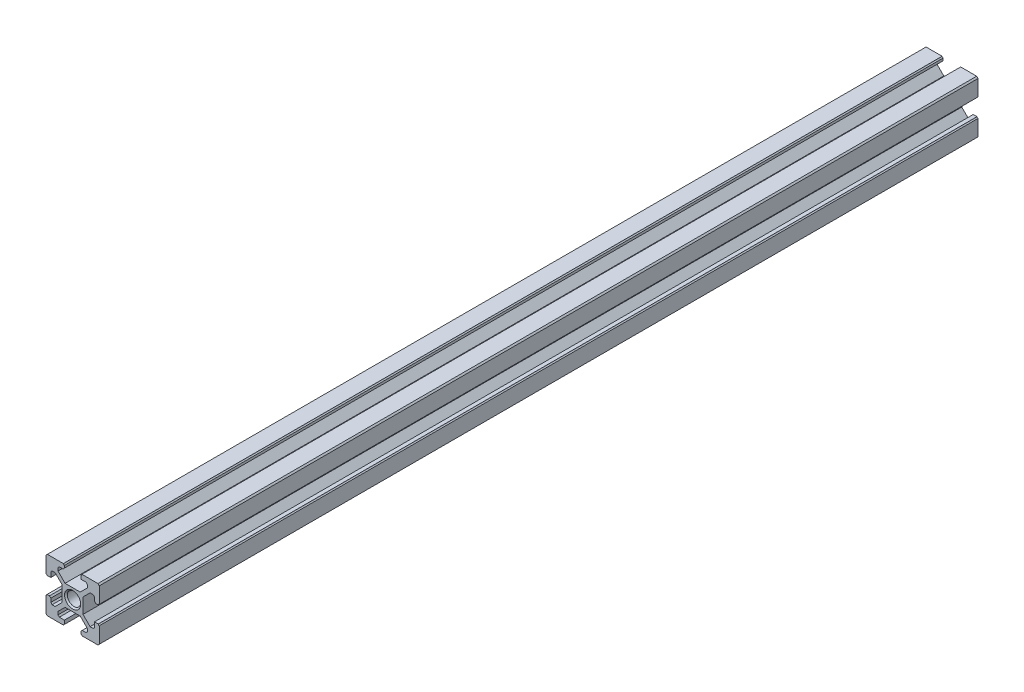
from build123d import *

# Parameters (mm, degrees)
BOSS_EXTRUDE1_DEPTH             = 330
M6X1_0_TAPPED_HOLE2_D           = 5
M6X1_0_TAPPED_HOLE2_DEPTH       = 28.497848452
M6X1_0_TAPPED_HOLE2_CSINK_D     = 6.05
M6X1_0_TAPPED_HOLE2_CSINK_ANGLE = 90
M6X1_0_TAPPED_HOLE2_TIP         = 1.502151548


with BuildPart() as part:
    # Sketch1 → Boss-Extrude1 (new body)
    with BuildSketch(Plane.XY):
        with BuildLine():
            Line((-9.5, 10), (-3.486470896, 10))
            ThreePointArc((-3.486470896, 10), (-3.373276191, 9.726723809), (-3.1, 9.613529104))
            Line((-3.1, 9.613529104), (-3.1, 8.7))
            Line((-3.1, 8.7), (-3.6, 8.2))
            Line((-3.6, 8.2), (-5, 8.2))
            Line((-5, 8.2), (-5.5, 7.7))
            Line((-5.5, 7.7), (-5.5, 6.560660172))
            Line((-5.5, 6.560660172), (-2.839339828, 3.9))
            Line((-2.839339828, 3.9), (0, 3.9))
            Line((0, 3.9), (2.839339828, 3.9))
            Line((2.839339828, 3.9), (5.5, 6.560660172))
            Line((5.5, 6.560660172), (5.5, 7.7))
            Line((5.5, 7.7), (5, 8.2))
            Line((5, 8.2), (3.1, 8.2))
            Line((3.1, 8.2), (3.1, 9.613529104))
            ThreePointArc((3.1, 9.613529104), (3.373276191, 9.726723809), (3.486470896, 10))
            Line((3.486470896, 10), (9.5, 10))
            Line((9.5, 10), (10, 9.5))
            Line((10, 9.5), (10, 3.486470896))
            ThreePointArc((10, 3.486470896), (9.726723809, 3.373276191), (9.613529104, 3.1))
            Line((9.613529104, 3.1), (8.7, 3.1))
            Line((8.7, 3.1), (8.2, 3.6))
            Line((8.2, 3.6), (8.2, 5))
            Line((8.2, 5), (7.7, 5.5))
            Line((7.7, 5.5), (6.560660172, 5.5))
            Line((6.560660172, 5.5), (3.9, 2.839339828))
            Line((3.9, 2.839339828), (3.9, 0))
            Line((3.9, 0), (3.9, -2.839339828))
            Line((3.9, -2.839339828), (6.560660172, -5.5))
            Line((6.560660172, -5.5), (7.7, -5.5))
            Line((7.7, -5.5), (8.2, -5))
            Line((8.2, -5), (8.2, -3.1))
            Line((8.2, -3.1), (9.613529104, -3.1))
            ThreePointArc((9.613529104, -3.1), (9.726723809, -3.373276191), (10, -3.486470896))
            Line((10, -3.486470896), (10, -9.5))
            Line((10, -9.5), (9.5, -10))
            Line((9.5, -10), (3.486470896, -10))
            ThreePointArc((3.486470896, -10), (3.373276191, -9.726723809), (3.1, -9.613529104))
            Line((3.1, -9.613529104), (3.1, -8.7))
            Line((3.1, -8.7), (3.6, -8.2))
            Line((3.6, -8.2), (5, -8.2))
            Line((5, -8.2), (5.5, -7.7))
            Line((5.5, -7.7), (5.5, -6.560660172))
            Line((5.5, -6.560660172), (2.839339828, -3.9))
            Line((2.839339828, -3.9), (0, -3.9))
            Line((0, -3.9), (-2.839339828, -3.9))
            Line((-2.839339828, -3.9), (-5.5, -6.560660172))
            Line((-5.5, -6.560660172), (-5.5, -7.7))
            Line((-5.5, -7.7), (-5, -8.2))
            Line((-5, -8.2), (-3.1, -8.2))
            Line((-3.1, -8.2), (-3.1, -9.613529104))
            ThreePointArc((-3.1, -9.613529104), (-3.373276191, -9.726723809), (-3.486470896, -10))
            Line((-3.486470896, -10), (-9.5, -10))
            Line((-9.5, -10), (-10, -9.5))
            Line((-10, -9.5), (-10, -3.486470896))
            ThreePointArc((-10, -3.486470896), (-9.726723809, -3.373276191), (-9.613529104, -3.1))
            Line((-9.613529104, -3.1), (-8.7, -3.1))
            Line((-8.7, -3.1), (-8.2, -3.6))
            Line((-8.2, -3.6), (-8.2, -5))
            Line((-8.2, -5), (-7.7, -5.5))
            Line((-7.7, -5.5), (-6.560660172, -5.5))
            Line((-6.560660172, -5.5), (-3.9, -2.839339828))
            Line((-3.9, -2.839339828), (-3.9, 0))
            Line((-3.9, 0), (-3.9, 2.839339828))
            Line((-3.9, 2.839339828), (-6.560660172, 5.5))
            Line((-6.560660172, 5.5), (-7.7, 5.5))
            Line((-7.7, 5.5), (-8.2, 5))
            Line((-8.2, 5), (-8.2, 3.1))
            Line((-8.2, 3.1), (-9.613529104, 3.1))
            ThreePointArc((-9.613529104, 3.1), (-9.726723809, 3.373276191), (-10, 3.486470896))
            Line((-10, 3.486470896), (-10, 9.5))
            Line((-10, 9.5), (-9.5, 10))
        make_face()
    extrude(amount=BOSS_EXTRUDE1_DEPTH)

    # Sketch2 → M6x1.0 Tapped Hole1 (revolve, cut)
    with BuildSketch(Plane(origin=(0, 0, 330), x_dir=(0, -1, 0), z_dir=(1, 0, 0))):
        Polygon((0, 0), (0, 30), (2.5, 28.497848452), (2.5, 0.525), (3.025, 0), align=None)
    revolve(axis=Axis((0, 0, 336.35), (0, 0, -1)), mode=Mode.SUBTRACT)

    # M6x1.0 Tapped Hole2
    with Locations(Plane(origin=(0, 0, 0), x_dir=(-1, 0, 0), z_dir=(0, 0, -1))):
        with Locations((0, 0)):
            CounterSinkHole(M6X1_0_TAPPED_HOLE2_D / 2, M6X1_0_TAPPED_HOLE2_CSINK_D / 2, depth=M6X1_0_TAPPED_HOLE2_DEPTH, counter_sink_angle=M6X1_0_TAPPED_HOLE2_CSINK_ANGLE)
            with Locations((0, 0, -(M6X1_0_TAPPED_HOLE2_DEPTH + M6X1_0_TAPPED_HOLE2_TIP / 2))):  # 118° drill point
                Cone(0, M6X1_0_TAPPED_HOLE2_D / 2, M6X1_0_TAPPED_HOLE2_TIP, mode=Mode.SUBTRACT)


solid = part.part
